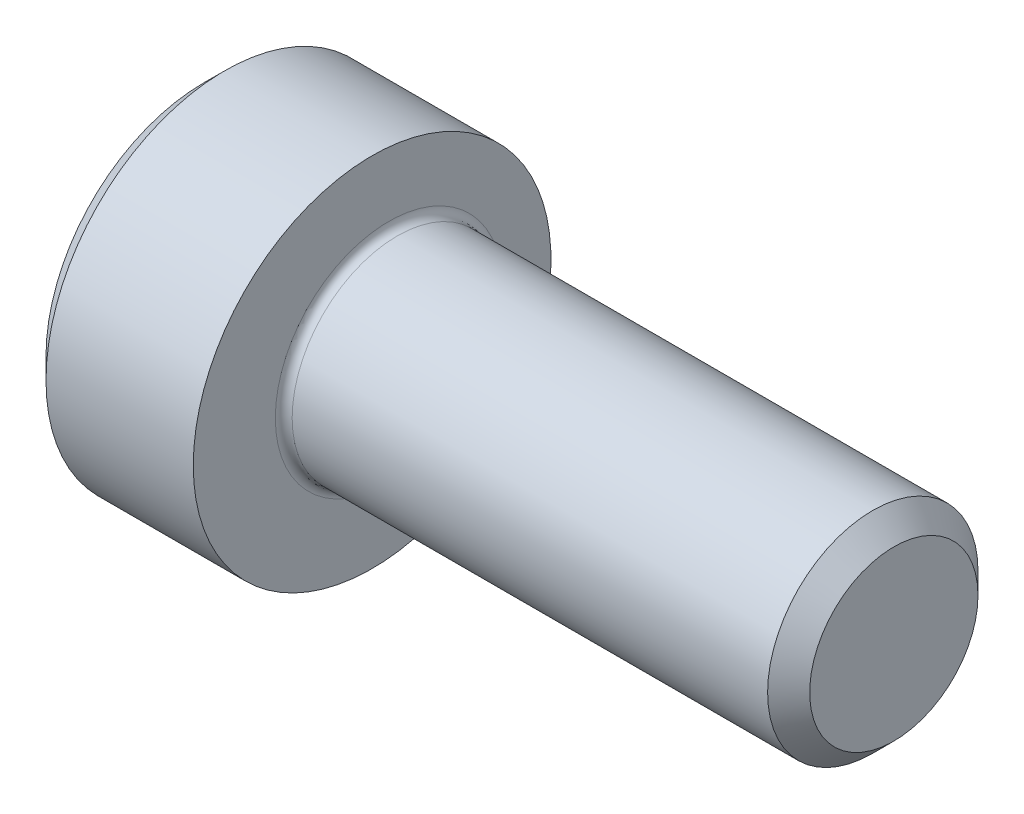
from build123d import *

# Parameters (mm, degrees)
ESBO_O1_W                = 4
ESBO_O1_H                = 4.25
ESBO_O2_R                = 2.5
RESSALTO_EXTRUS_O1_DEPTH = 12
CORTE_EXTRUS_O1_DEPTH    = 2.5
CHANFRO1_SIZE            = 0.5
FILETE1_R                = 0.2
SKETCH1_R                = 0.25
CUT_EXTRUDE1_DEPTH       = 0.2


with BuildPart() as part:
    # Esboço1 → Revolução1 (revolve)
    with BuildSketch(Plane(origin=(0, 0, 0), x_dir=(-1, 0, 0), z_dir=(0, 0, -1)), mode=Mode.PRIVATE) as revolu_o1_sk:
        with Locations((-2, 2.125)):
            Rectangle(ESBO_O1_W, ESBO_O1_H)
    revolve(revolu_o1_sk.sketch.rotate(Axis((4, 0, 0), (-1, 0, 0)), 270), axis=Axis((4, 0, 0), (-1, 0, 0)))

    # Esboço2 → Ressalto-extrusão1 (add)
    with BuildSketch(Plane(origin=(4, 0, 0), x_dir=(0, 0, -1), z_dir=(1, 0, 0))):
        with Locations((0.4, 0)):
            Circle(ESBO_O2_R)
    extrude(amount=RESSALTO_EXTRUS_O1_DEPTH)

    # Esboço3 → Corte-extrusão1 (cut)
    with BuildSketch(Plane.ZY):
        Polygon((0, -2.357898499), (2.042, -1.17894925), (2.042, 1.17894925), (0, 2.357898499), (-2.042, 1.17894925), (-2.042, -1.17894925), align=None)
    extrude(amount=-CORTE_EXTRUS_O1_DEPTH, mode=Mode.SUBTRACT)

    # Esboço4 → Corte-Revolução1 (revolve, cut)
    with BuildSketch(Plane.XY, mode=Mode.PRIVATE) as corte_revolu_o1_sk:
        Polygon((2.5, 2.042), (2.5, 0), (3.67894925, 0), align=None)
    revolve(corte_revolu_o1_sk.sketch.rotate(Axis((2.5, 0, 0), (1, 0, 0)), 90), axis=Axis((2.5, 0, 0), (1, 0, 0)), mode=Mode.SUBTRACT)

    # Chanfro1
    chanfro1_edges = [part.edges().sort_by_distance(p)[0] for p in [
        (0, 0, -4.25),
        (16, 0, 2.1),
    ]]
    chamfer(chanfro1_edges, length=CHANFRO1_SIZE)

    # Filete1
    filete1_edges = [part.edges().sort_by_distance(p)[0] for p in [
        (4, 0, 2.1),
    ]]
    fillet(filete1_edges, radius=FILETE1_R)

    # Sketch1 → Cut-Extrude1 (cut)
    with BuildSketch(Plane.ZY):
        with Locations((2.8, 0)):
            Circle(SKETCH1_R)
    extrude(amount=-CUT_EXTRUDE1_DEPTH, mode=Mode.SUBTRACT)


solid = part.part
